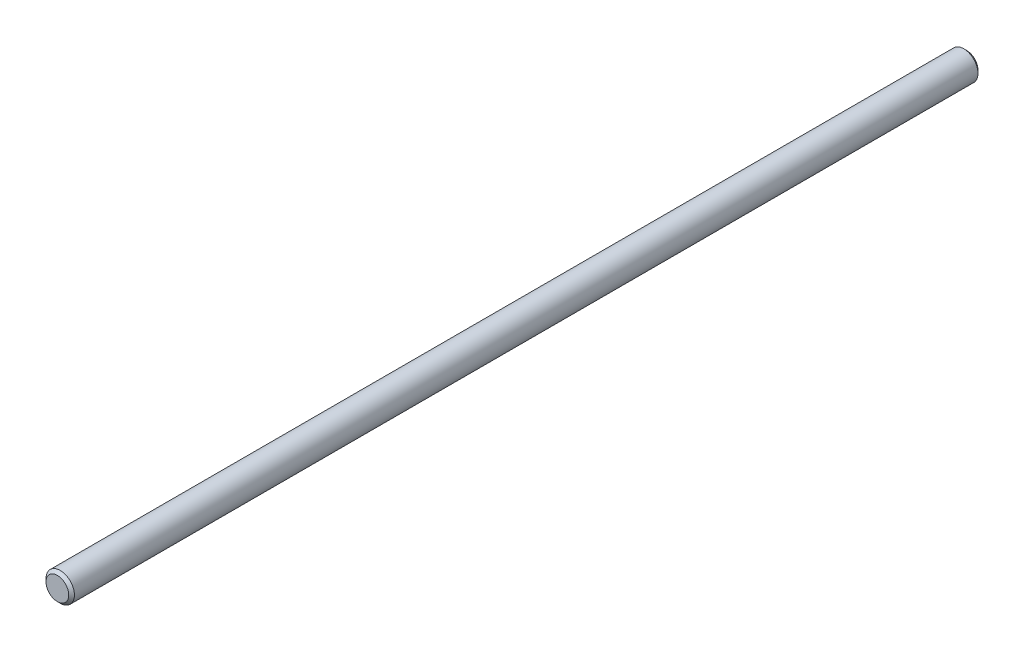
from build123d import *

# Parameters (mm, degrees)
SKETCH1_R      = 9.525
EXTRUDE1_DEPTH = 304.8
CHAMFER1_SIZE  = 1.905


with BuildPart() as part:
    # Sketch1 → Extrude1 (new, symmetric)
    with BuildSketch(Plane.XY):
        with Locations(Location((0, 0, 0), (0, 0, 180))):
            Circle(SKETCH1_R)
    extrude(amount=EXTRUDE1_DEPTH, both=True)

    # Chamfer1
    chamfer1_edges = [part.edges().sort_by_distance(p)[0] for p in [
        (9.525, 0, -304.8),
        (9.525, 0, 304.8),
    ]]
    chamfer(chamfer1_edges, length=CHAMFER1_SIZE)


solid = part.part
